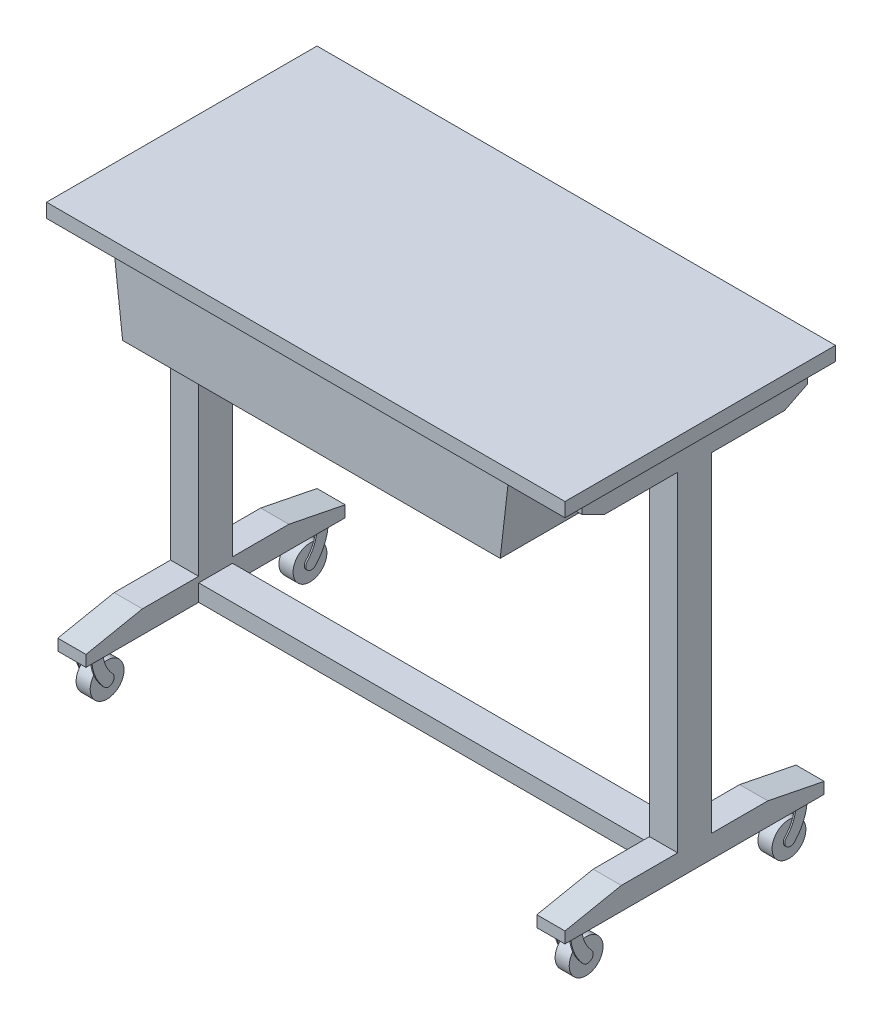
from build123d import *

# Parameters (mm, degrees)
SKETCH2_W                       = 1168.4
SKETCH2_H                       = 609.6
BOSS_EXTRUDE1_DEPTH             = 31.75
SKETCH4_W                       = 1143
SKETCH4_H                       = 50.8
BOSS_EXTRUDE2_DEPTH             = 38.1
BOSS_EXTRUDE3_DEPTH             = 292.1
BOSS_EXTRUDE3_DEPTH_BACK        = 139.7
BOSS_EXTRUDE4_DEPTH             = 63.5
BOSS_EXTRUDE7_REACH             = 1098.401
SKETCH10_W                      = 76.2
SKETCH10_H                      = 38.1
BOSS_EXTRUDE7_DIRECTION_2_REACH = 1098.401
SKETCH8_R                       = 38.1
BOSS_EXTRUDE5_DEPTH             = 15.875
BOSS_EXTRUDE5_2_DEPTH           = 15.875
BOSS_EXTRUDE6_DEPTH             = 3.175


with BuildPart() as part:
    # Sketch2 → Boss-Extrude1 (new body)
    with BuildSketch(Plane(origin=(0, 0, 0), x_dir=(1, 0, 0), z_dir=(0, 1, 0))):
        Rectangle(SKETCH2_W, SKETCH2_H)
    extrude(amount=-BOSS_EXTRUDE1_DEPTH)


with BuildPart() as body_2:
    # Sketch4 → Boss-Extrude2 (new, symmetric)
    with BuildSketch(Plane.XY):
        with Locations((0, -57.15)):
            Rectangle(SKETCH4_W, SKETCH4_H)
    extrude(amount=BOSS_EXTRUDE2_DEPTH, both=True)

    # Sketch5 → Boss-Extrude3 (add, two sides: drawn at the far end of the back side and taken through both)
    with BuildSketch(Plane.XY.offset(-BOSS_EXTRUDE3_DEPTH_BACK)):
        Polygon((-444.5, -31.75), (444.5, -31.75), (425.45, -196.85), (-425.45, -196.85), align=None)
    extrude(amount=BOSS_EXTRUDE3_DEPTH + BOSS_EXTRUDE3_DEPTH_BACK)

    # Sketch6 → Boss-Extrude4 (add)
    with BuildSketch(Plane(origin=(571.5, 0, 0), x_dir=(0, 0, -1), z_dir=(1, 0, 0))):
        Polygon((-38.1, -825.5), (-165.1, -825.5), (-292.1, -850.9), (-292.1, -876.3), (292.1, -876.3), (292.1, -850.9), (165.1, -825.5), (38.1, -825.5), (38.1, -82.55), (203.2, -82.55), (254, -57.15), (254, -31.75), (-254, -31.75), (-254, -57.15), (-203.2, -82.55), (-38.1, -82.55), align=None)
    boss_extrude4 = extrude(amount=-BOSS_EXTRUDE4_DEPTH)

    # Mirror1: Boss-Extrude4 across plane
    add(boss_extrude4.mirror(Plane(origin=(0, 0, 0), x_dir=(0, 0, 1), z_dir=(1, 0, 0))))

    # Boss-Extrude7: up to this face of the body (flat: up to its plane)
    boss_extrude7_end = Plane(body_2.part.faces().sort_by_distance((508, -581.066100324, 0))[0])
    # Sketch10 → Boss-Extrude7 (add, up to the picked face)
    with BuildSketch(Plane(origin=(0, 0, 0), x_dir=(0, 0, -1), z_dir=(1, 0, 0)), mode=Mode.PRIVATE) as boss_extrude7_sk1:
        with Locations((0, -857.25)):
            Rectangle(SKETCH10_W, SKETCH10_H)
    boss_extrude7_tool1 = split(extrude(boss_extrude7_sk1.sketch, amount=BOSS_EXTRUDE7_REACH, mode=Mode.PRIVATE), bisect_by=boss_extrude7_end, keep=Keep.BOTH, mode=Mode.PRIVATE)
    add(boss_extrude7_tool1.solids().sort_by(Axis((0, -857.25, 0), (1, 0, 0)))[0])

    # Boss-Extrude7 direction 2: up to this face of the body (flat: up to its plane)
    boss_extrude7_direction_2_end = Plane(body_2.part.faces().sort_by_distance((-508, -581.066100324, 0))[0])
    # Sketch10 → Boss-Extrude7 direction 2 (add, up to the picked face)
    with BuildSketch(Plane(origin=(0, 0, 0), x_dir=(0, 0, -1), z_dir=(1, 0, 0)), mode=Mode.PRIVATE) as boss_extrude7_direction_2_sk1:
        with Locations((0, -857.25)):
            Rectangle(SKETCH10_W, SKETCH10_H)
    boss_extrude7_direction_2_tool1 = split(extrude(boss_extrude7_direction_2_sk1.sketch, amount=-BOSS_EXTRUDE7_DIRECTION_2_REACH, mode=Mode.PRIVATE), bisect_by=boss_extrude7_direction_2_end, keep=Keep.BOTH, mode=Mode.PRIVATE)
    add(boss_extrude7_direction_2_tool1.solids().sort_by(Axis((0, -857.25, 0), (-1, 0, 0)))[0])


with BuildPart() as body_3:
    # Sketch8 → Boss-Extrude5 (new, symmetric)
    with BuildSketch(Plane(origin=(539.75, 0, 0), x_dir=(0, 0, -1), z_dir=(1, 0, 0))):
        with Locations((-228.6, -939.8)):
            Circle(SKETCH8_R)
    extrude(amount=BOSS_EXTRUDE5_DEPTH, both=True)


with BuildPart() as body_4:
    # Sketch8 → Boss-Extrude5 2 (new, symmetric)
    with BuildSketch(Plane(origin=(539.75, 0, 0), x_dir=(0, 0, -1), z_dir=(1, 0, 0))):
        with Locations((228.6, -939.8)):
            Circle(SKETCH8_R)
    extrude(amount=BOSS_EXTRUDE5_2_DEPTH, both=True)


    add(body_3.part)  # Boss-Extrude6 merges body 3
    # Sketch9 → Boss-Extrude6 (add)
    with BuildSketch(Plane(origin=(555.625, 0, 0), x_dir=(0, 0, -1), z_dir=(1, 0, 0))):
        with BuildLine():
            Line((-266.7, -876.3), (-241.3, -876.3))
            ThreePointArc((-241.3, -876.3), (-235.622837339, -905.779134936), (-219.403448276, -931.04137931))
            ThreePointArc((-219.403448276, -931.04137931), (-219.84137931, -948.996551724), (-237.796551724, -948.55862069))
            ThreePointArc((-237.796551724, -948.55862069), (-259.206145288, -915.212458115), (-266.7, -876.3))
        make_face()
        with BuildLine():
            Line((266.7, -876.3), (241.3, -876.3))
            ThreePointArc((241.3, -876.3), (235.622837339, -905.779134936), (219.403448276, -931.04137931))
            ThreePointArc((219.403448276, -931.04137931), (219.84137931, -948.996551724), (237.796551724, -948.55862069))
            ThreePointArc((237.796551724, -948.55862069), (259.206145288, -915.212458115), (266.7, -876.3))
        make_face()
    boss_extrude6 = extrude(amount=BOSS_EXTRUDE6_DEPTH)

    # Mirror2: Boss-Extrude6 across plane
    add(boss_extrude6.mirror(Plane(origin=(539.75, 0, 0), x_dir=(0, 0, 1), z_dir=(1, 0, 0))))


with BuildPart() as body_4_2:
    # Mirror3: mirrored copy
    add(body_4.part.mirror(Plane(origin=(0, 0, 0), x_dir=(0, 0, 1), z_dir=(1, 0, 0))))


solid = Compound([part.part, body_2.part, body_4.part, body_4_2.part])
